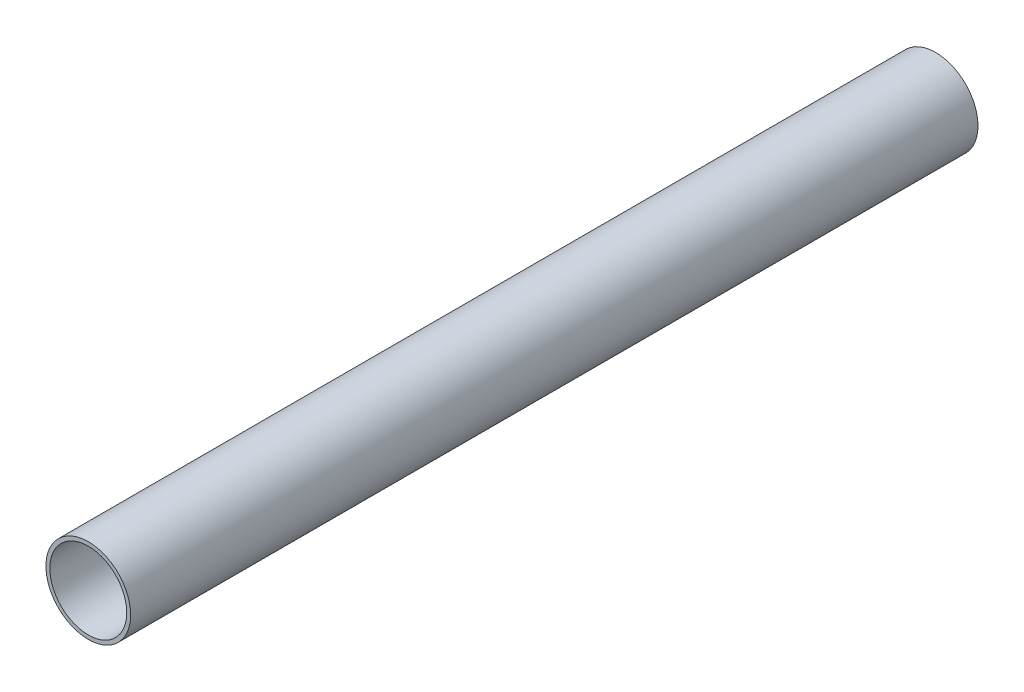
from build123d import *

# Parameters (mm, degrees)
SKIZZE1_R                       = 12.5
SKIZZE1_R_2                     = 11.35
AUFSATZ_LINEAR_AUSTRAGEN1_DEPTH = 250


with BuildPart() as part:
    # Skizze1 → Aufsatz-Linear austragen1 (new body)
    with BuildSketch(Plane.XY):
        Circle(SKIZZE1_R)
        Circle(SKIZZE1_R_2, mode=Mode.SUBTRACT)
    extrude(amount=AUFSATZ_LINEAR_AUSTRAGEN1_DEPTH)


solid = part.part
